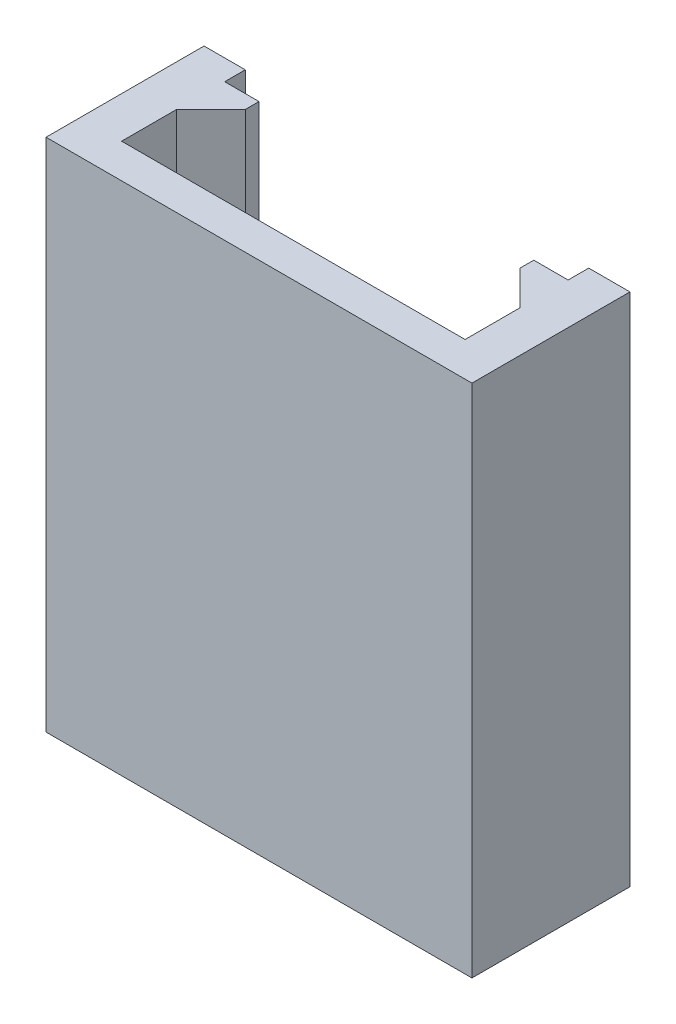
from build123d import *

# Parameters (mm, degrees)
P_IDAT_VYSUNUT_M1_DEPTH = 15


with BuildPart() as part:
    # Skica1 → Přidat vysunutím1 (new body)
    with BuildSketch(Plane(origin=(0, 0, 0), x_dir=(1, 0, 0), z_dir=(0, 1, 0))):
        Polygon((-5, 0), (5, 0), (5, 1.6), (4, 2.6), (4, 3), (5, 3), (5, 3.6), (6.2, 3.6), (6.2, -1), (-6.2, -1), (-6.2, 3.6), (-5, 3.6), (-5, 3), (-4, 3), (-4, 2.6), (-5, 1.6), align=None)
    extrude(amount=P_IDAT_VYSUNUT_M1_DEPTH)


solid = part.part
